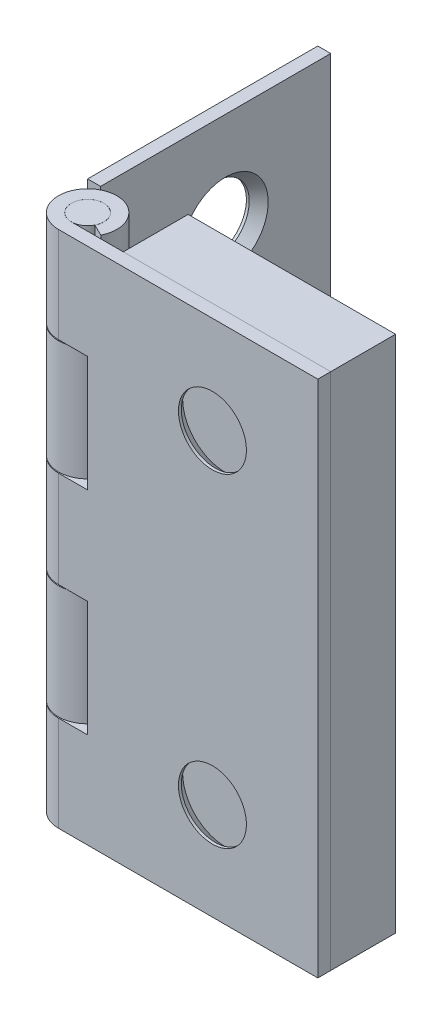
from build123d import *

# Parameters (mm, degrees)
EXTRUDE1_DEPTH          = 12.7
LPATTERN2_COUNT         = 2
LPATTERN2_PITCH         = 15.875
CUT_EXTRUDE1_DEPTH      = 22.997045256
CUT_EXTRUDE1_DEPTH_BACK = 22.997045256
SKETCH4_W               = 2.8575
SKETCH4_H               = 5.6642
CUT_EXTRUDE2_DEPTH      = 1.42875
CUT_EXTRUDE2_DEPTH_BACK = 1.42875
SKETCH5_W               = 2.8575
SKETCH5_H               = 4.7244
SKETCH5_H_2             = 4.826
EXTRUDE2_START          = -12.7
SKETCH6_R               = 0.79121
EXTRUDE2_DEPTH          = 25.4
SKETCH9_W               = 10.16
SKETCH9_H               = 25.4
BOSS_EXTRUDE1_DEPTH     = 3.175


with BuildPart() as part:
    # Sketch1 → Extrude1 (new, symmetric)
    with BuildSketch(Plane(origin=(0, 0, 0), x_dir=(1, 0, 0), z_dir=(0, 1, 0))):
        with BuildLine():
            Line((0, -0.79375), (12.7, -0.79375))
            Line((12.7, -0.79375), (12.7, -1.42875))
            Line((12.7, -1.42875), (0, -1.42875))
            ThreePointArc((0, -1.42875), (-0.753017368, 1.214204022), (1.279883418, -0.635))
            Line((1.279883418, -0.635), (0.711046343, -0.352777778))
            ThreePointArc((0.711046343, -0.352777778), (-0.418342982, 0.67455779), (0, -0.79375))
        make_face()
    extrude(amount=EXTRUDE1_DEPTH, both=True)

    # Sketch7 → Cut-Revolve1 (revolve, cut)
    with BuildSketch(Plane(origin=(7.540625, 0, 0), x_dir=(0, 0, -1), z_dir=(1, 0, 0)), mode=Mode.PRIVATE) as cut_revolve1_sk:
        Polygon((-0.79375, 7.9375), (-0.79375, 10.033), (-1.290479078, 9.6012), (-1.42875, 9.6012), (-1.42875, 7.9375), align=None)
    cut_revolve1 = revolve(cut_revolve1_sk.sketch.rotate(Axis((7.540625, 7.9375, -1.822321443), (0, 0, 1)), 90), axis=Axis((7.540625, 7.9375, -1.822321443), (0, 0, 1)), mode=Mode.SUBTRACT)

    # LPattern2: Cut-Revolve1 ×2
    with Locations(*[(0, -i * LPATTERN2_PITCH, 0) for i in range(1, LPATTERN2_COUNT)]):
        add(cut_revolve1, mode=Mode.SUBTRACT)


with BuildPart() as body_2:
    # Mirror2: mirrored copy
    add(part.part.mirror(Plane(origin=(0, 0, 0), x_dir=(-0.7071067811865439, 0, 0.7071067811865512), z_dir=(0.7071067811865513, 0, 0.7071067811865438))))

    # Sketch5 → Cut-Extrude2 (cut, two sides: drawn at the far end of the back side and taken through both)
    with BuildSketch(Plane.XY.offset(-CUT_EXTRUDE2_DEPTH_BACK)):
        with Locations((0, -10.3378)):
            Rectangle(SKETCH5_W, SKETCH5_H)
        Rectangle(SKETCH5_W, SKETCH5_H_2)
        with Locations((0, 10.3378)):
            Rectangle(SKETCH5_W, SKETCH5_H)
    extrude(amount=CUT_EXTRUDE2_DEPTH + CUT_EXTRUDE2_DEPTH_BACK, mode=Mode.SUBTRACT)


with BuildPart() as part_1:
    add(part.part)

    # Sketch4 → Cut-Extrude1 (cut, two sides: drawn at the far end of the back side and taken through both)
    with BuildSketch(Plane.XY.offset(-CUT_EXTRUDE1_DEPTH_BACK)):
        with Locations((0, 5.1943)):
            Rectangle(SKETCH4_W, SKETCH4_H)
        with Locations((0, -5.1943)):
            Rectangle(SKETCH4_W, SKETCH4_H)
    extrude(amount=CUT_EXTRUDE1_DEPTH + CUT_EXTRUDE1_DEPTH_BACK, mode=Mode.SUBTRACT)


with BuildPart() as body_3:
    # Sketch6 → Extrude2 (new body)
    with BuildSketch(Plane(origin=(0, 0, 0), x_dir=(1, 0, 0), z_dir=(0, 1, 0)).offset(EXTRUDE2_START)):
        with Locations(Location((0, 0, 0), (0, 0, 270))):
            Circle(SKETCH6_R)
    extrude(amount=EXTRUDE2_DEPTH)


with BuildPart() as body_4:
    # Sketch9 → Boss-Extrude1 (new body)
    with BuildSketch(Plane(origin=(0, 0, 0.79375), x_dir=(-1, 0, 0), z_dir=(0, 0, -1))):
        with Locations((-7.62, 0)):
            Rectangle(SKETCH9_W, SKETCH9_H)
    extrude(amount=BOSS_EXTRUDE1_DEPTH)


solid = Compound([body_2.part, part_1.part, body_3.part, body_4.part])
